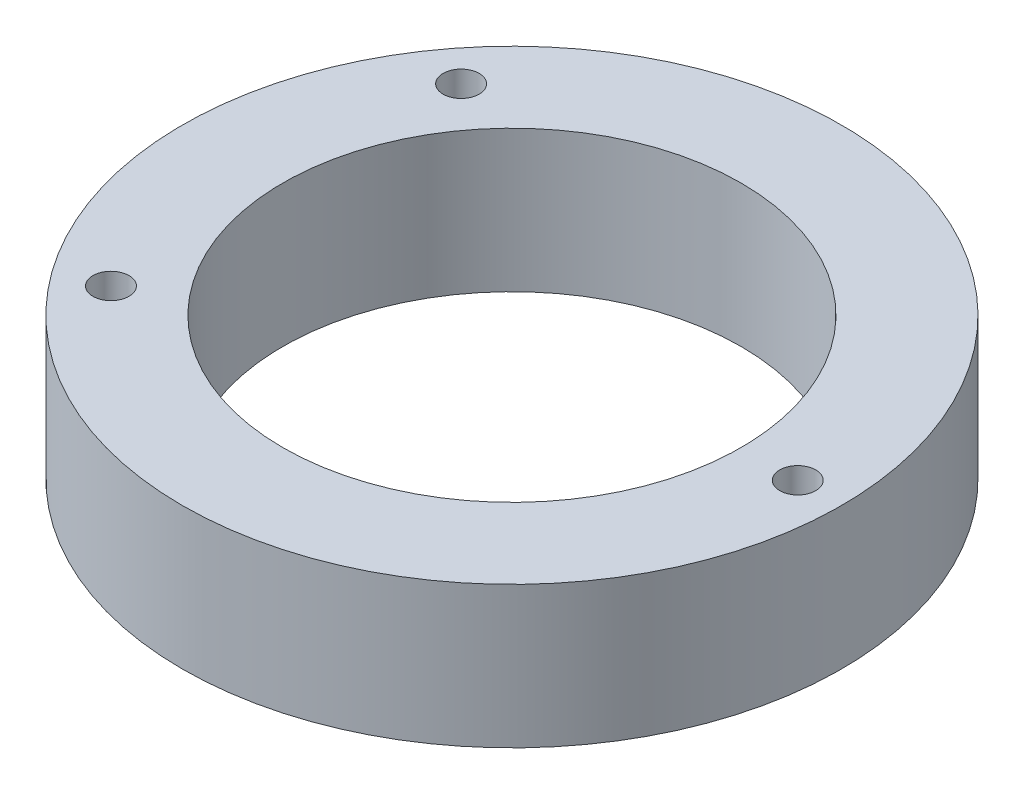
from build123d import *

# Parameters (mm, degrees)
SKETCH2_R           = 32
SKETCH2_R_2         = 22.25
SKETCH2_R_3         = 1.75
BOSS_EXTRUDE1_DEPTH = 13.75


with BuildPart() as part:
    # Sketch2 → Boss-Extrude1 (new body)
    with BuildSketch(Plane(origin=(0, 0, 0), x_dir=(1, 0, 0), z_dir=(0, 1, 0))):
        with Locations(Location((0, 0, 0), (0, 0, 270))):
            Circle(SKETCH2_R)
        with Locations(Location((0, 0, 0), (0, 0, 270))):
            Circle(SKETCH2_R_2, mode=Mode.SUBTRACT)
        with Locations(Location((27.75, 0, 0), (0, 0, 270))):
            Circle(SKETCH2_R_3, mode=Mode.SUBTRACT)
        with Locations(Location((-21.932737229, -17.000515805, 0), (0, 0, 270))):
            Circle(SKETCH2_R_3, mode=Mode.SUBTRACT)
        with Locations(Location((-21.932737229, 17.000515805, 0), (0, 0, 270))):
            Circle(SKETCH2_R_3, mode=Mode.SUBTRACT)
    extrude(amount=BOSS_EXTRUDE1_DEPTH)


solid = part.part
